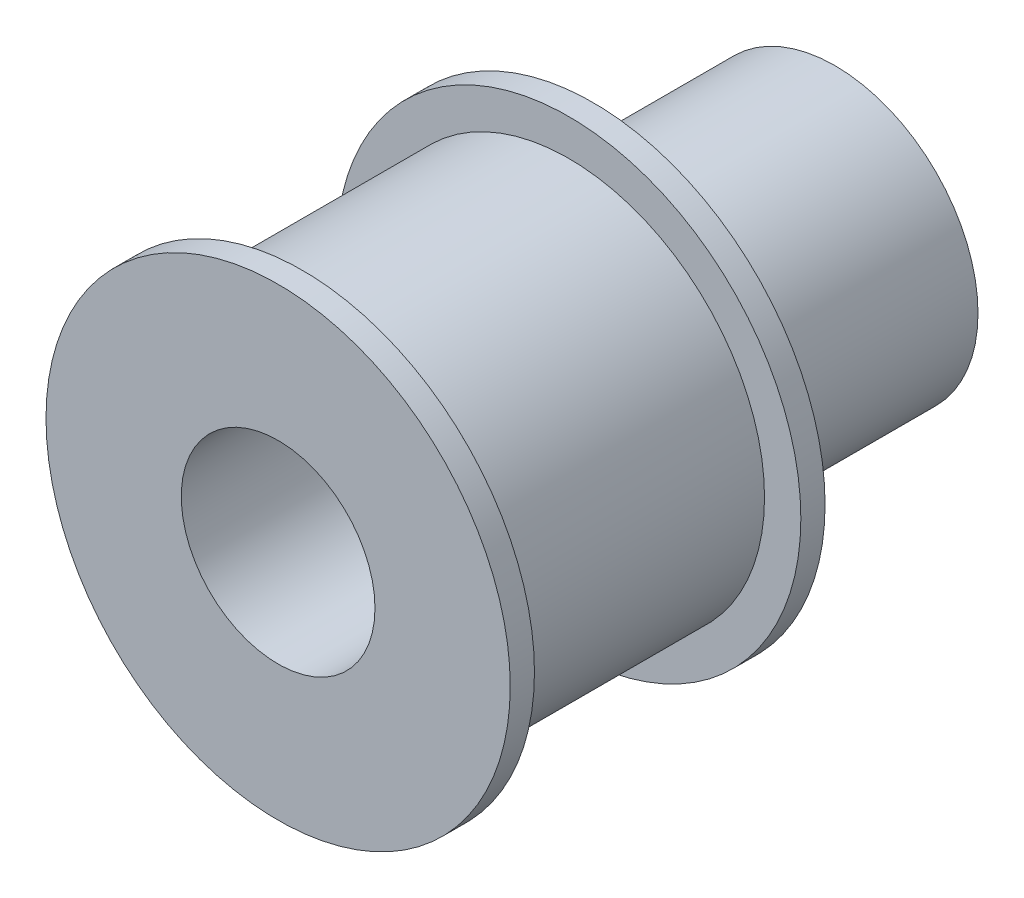
from build123d import *

# Parameters (mm, degrees)
SKETCH2_R          = 4
CUT_EXTRUDE1_DEPTH = 27.697325265
SKETCH3_R          = 1.5
CUT_EXTRUDE2_DEPTH = 27.697325265
SKETCH4_R          = 1.5
CUT_EXTRUDE3_DEPTH = 27.697325352


with BuildPart() as part:
    # Sketch1 → Revolve1 (revolve)
    with BuildSketch(Plane(origin=(0, 0, 0), x_dir=(1, 0, 0), z_dir=(0, 1, 0)), mode=Mode.PRIVATE) as revolve1_sk:
        Polygon((0, 23), (-5.9, 23), (-5.9, 13), (-9.585071109, 13), (-9.585071109, 12), (-8.085071109, 12), (-8.085071109, 1), (-9.585071109, 1), (-9.585071109, 0), (0, 0), align=None)
    revolve(revolve1_sk.sketch.rotate(Axis((0, 0, 0), (0, 0, -1)), 180), axis=Axis((0, 0, 0), (0, 0, -1)))

    # Sketch2 → Cut-Extrude1 (cut, through all)
    with BuildSketch(Plane.XY):
        Circle(SKETCH2_R)
    extrude(amount=-CUT_EXTRUDE1_DEPTH, mode=Mode.SUBTRACT)

    # Sketch3 → Cut-Extrude2 (cut, through all)
    with BuildSketch(Plane(origin=(0, 0, 0), x_dir=(1, 0, 0), z_dir=(0, 1, 0))):
        with Locations(Location((0, 18, 0), (0, 0, 270))):
            Circle(SKETCH3_R)
    extrude(amount=-CUT_EXTRUDE2_DEPTH, mode=Mode.SUBTRACT)

    # Sketch4 → Cut-Extrude3 (cut, through all)
    with BuildSketch(Plane(origin=(0, 0, 0), x_dir=(0, 0, -1), z_dir=(1, 0, 0))):
        with Locations((18, 0)):
            Circle(SKETCH4_R)
    extrude(amount=-CUT_EXTRUDE3_DEPTH, mode=Mode.SUBTRACT)


solid = part.part
